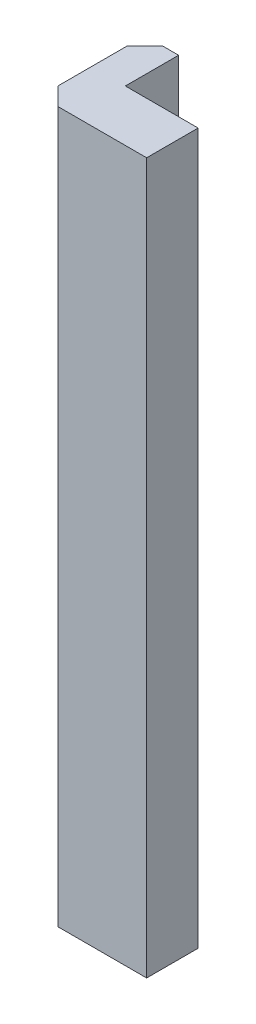
from build123d import *

# Parameters (mm, degrees)
BOSS_EXTRUDE1_DEPTH = 40


with BuildPart() as part:
    # Sketch1 → Boss-Extrude1 (new body)
    with BuildSketch(Plane(origin=(0, 0, 0), x_dir=(1, 0, 0), z_dir=(0, 1, 0))):
        Polygon((0, -2), (1, -3), (6, -3), (6, -0.1), (1.9, -0.1), (1.9, 2.9), (1, 2.9), (0, 1.9), (0, 0), align=None)
    extrude(amount=BOSS_EXTRUDE1_DEPTH)


solid = part.part
